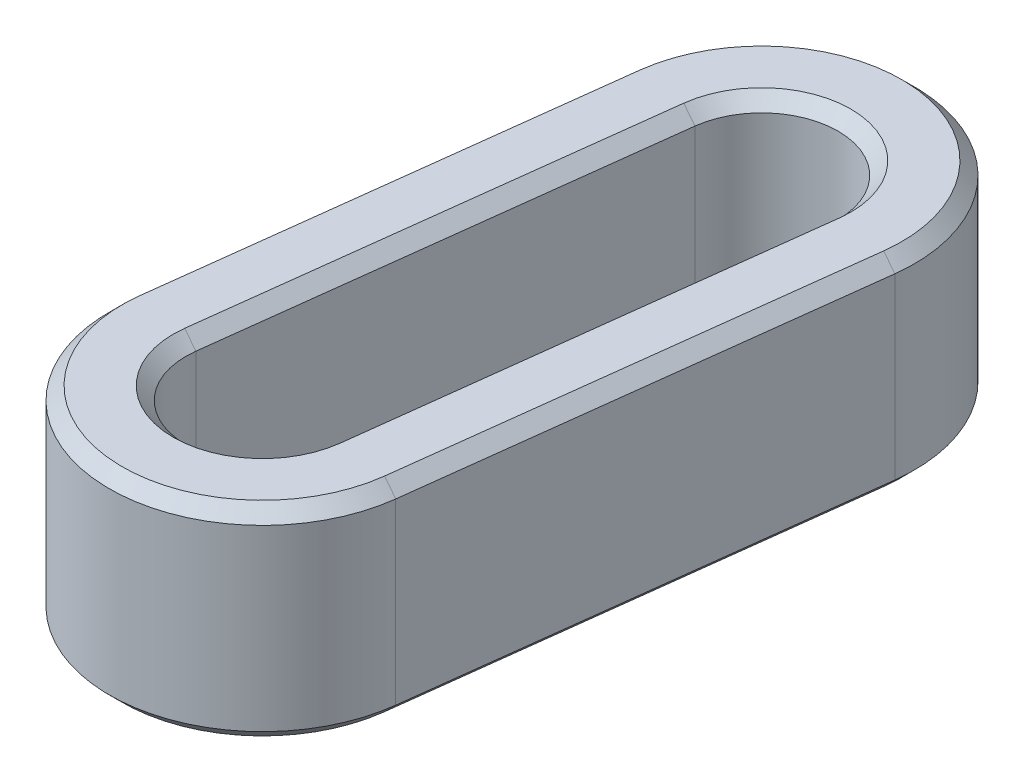
from build123d import *

# Parameters (mm, degrees)
BOSS_EXTRUDE1_DEPTH = 8
CHAMFER1_SIZE       = 0.5


with BuildPart() as part:
    # Sketch1 → Boss-Extrude1 (new body)
    with BuildSketch(Plane(origin=(0, 0, 0), x_dir=(1, 0, 0), z_dir=(0, 1, 0))):
        with BuildLine():
            Line((-29.422447973, -80.393109081), (-27.283313621, -62.971257862))
            ThreePointArc((-27.283313621, -62.971257862), (-20.596820651, -57.747197013), (-15.372759802, -64.433689983))
            Line((-15.372759802, -64.433689983), (-17.511894154, -81.855541202))
            ThreePointArc((-17.511894154, -81.855541202), (-24.198387124, -87.079602051), (-29.422447973, -80.393109081))
        make_face()
        with BuildLine():
            Line((-26.444809519, -80.758717111), (-24.305675167, -63.336865893))
            ThreePointArc((-24.305675167, -63.336865893), (-20.962428681, -60.724835468), (-18.350398257, -64.068081953))
            Line((-18.350398257, -64.068081953), (-20.489532609, -81.489933172))
            ThreePointArc((-20.489532609, -81.489933172), (-23.832779094, -84.101963596), (-26.444809519, -80.758717111))
        make_face(mode=Mode.SUBTRACT)
    extrude(amount=BOSS_EXTRUDE1_DEPTH)

    # Chamfer1
    chamfer1_edges = [part.edges().sort_by_distance(p)[0] for p in [
        (-20.596820651, 8, 57.747197013),
        (-28.352880797, 8, 71.682183472),
        (-20.962428681, 0, 60.724835468),
        (-25.375242343, 0, 72.047791502),
        (-23.832779094, 0, 84.101963596),
        (-19.419965433, 0, 72.779007562),
        (-20.962428681, 8, 60.724835468),
        (-25.375242343, 8, 72.047791502),
        (-23.832779094, 8, 84.101963596),
        (-19.419965433, 8, 72.779007562),
        (-24.198387124, 8, 87.079602051),
        (-28.352880797, 0, 71.682183472),
        (-20.596820651, 0, 57.747197013),
        (-16.442326978, 0, 73.144615593),
        (-24.198387124, 0, 87.079602051),
        (-16.442326978, 8, 73.144615593),
    ]]
    chamfer(chamfer1_edges, length=CHAMFER1_SIZE)


solid = part.part
